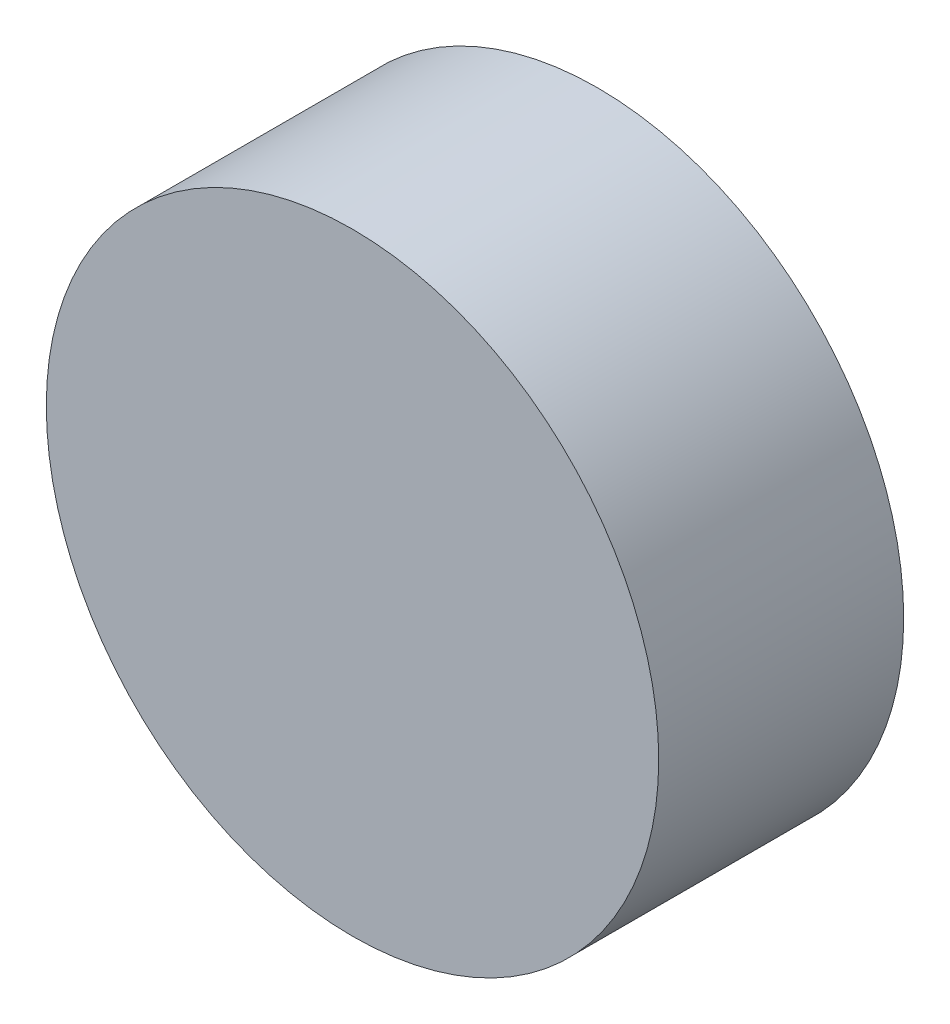
from build123d import *

# Parameters (mm, degrees)
MTG_KASNAK_D30_KAYIS_START = 6
SKETCH1_R                  = 15
MTG_KASNAK_D30_KAYIS_DEPTH = 12


with BuildPart() as part:
    # Sketch1 → MTG_kasnak_D30_kayis (new body)
    with BuildSketch(Plane.XY.offset(MTG_KASNAK_D30_KAYIS_START)):
        Circle(SKETCH1_R)
    extrude(amount=-MTG_KASNAK_D30_KAYIS_DEPTH)


solid = part.part
